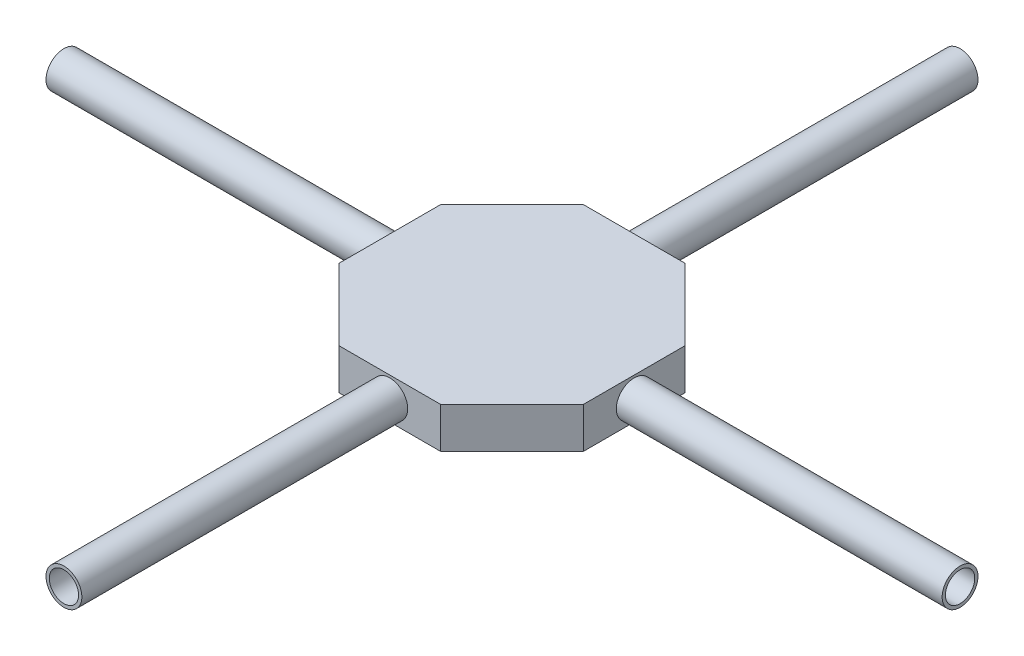
from build123d import *

# Parameters (mm, degrees)
BOSS_EXTRUDE1_DEPTH = 25
SKETCH2_R           = 11
SKETCH2_R_2         = 9
BOSS_EXTRUDE2_DEPTH = 200
CIRPATTERN1_COUNT   = 4


with BuildPart() as part:
    # Sketch1 → Boss-Extrude1 (new body)
    with BuildSketch(Plane(origin=(0, 0, 0), x_dir=(1, 0, 0), z_dir=(0, 1, 0))):
        Polygon((-75, 31.066017178), (-75, -31.066017178), (-31.066017178, -75), (31.066017178, -75), (75, -31.066017178), (75, 31.066017178), (31.066017178, 75), (-31.066017178, 75), align=None)
    extrude(amount=BOSS_EXTRUDE1_DEPTH)

    # Sketch2 → Boss-Extrude2 (add)
    with BuildSketch(Plane.ZY.offset(75)):
        with Locations((0, 12.5)):
            Circle(SKETCH2_R)
        with Locations((0, 12.5)):
            Circle(SKETCH2_R_2, mode=Mode.SUBTRACT)
    boss_extrude2 = extrude(amount=BOSS_EXTRUDE2_DEPTH)

    # CirPattern1: Boss-Extrude2 ×4 about axis
    cirpattern1_axis = Axis((0, 0, 0), (0, 1, 0))
    for i in range(1, CIRPATTERN1_COUNT):
        add(boss_extrude2.rotate(cirpattern1_axis, i * 360 / CIRPATTERN1_COUNT))


solid = part.part
